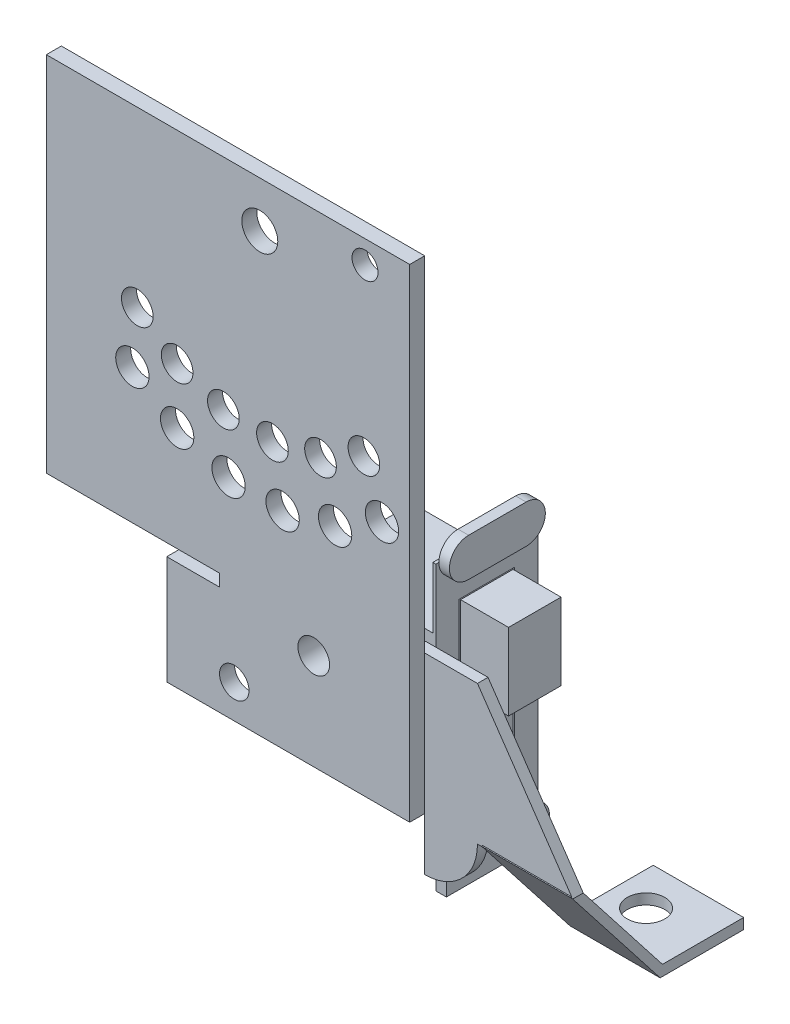
from build123d import *
from build123d.topology import SkipClean

# Parameters (mm, degrees)
SKETCH1_R                = 1.905
SKETCH1_R_2              = 1.37795
BOSS_EXTRUDE1_DEPTH      = 1.5875
CUT_EXTRUDE1_REACH       = 39.342
SKETCH2_R                = 1.7653
SKETCH2_R_2              = 1.6764
SKETCH2_R_3              = 1.5621
SKETCH3_R                = 1.6764
BOSS_EXTRUDE2_DEPTH      = 1.1176
BOSS_EXTRUDE3_DEPTH      = 0.4572
BOSS_EXTRUDE3_DEPTH_BACK = 14.732
SKETCH4_W                = 9.5758
SKETCH4_H                = 0.880680818
CUT_EXTRUDE4_DEPTH       = 57.741944576
BOSS_EXTRUDE5_DEPTH      = 0.7112
BOSS_EXTRUDE5_DEPTH_BACK = 8.128
SKETCH8_W                = 9.5758
SKETCH8_H                = 1.1176
SKETCH9_W                = 12.954
SKETCH9_H                = 15.875
BOSS_EXTRUDE10_DEPTH     = 10.795
SKETCH10_W               = 0.3175
SKETCH10_H               = 27.94
BOSS_EXTRUDE12_DEPTH     = 10.795
SKETCH11_W               = 5.55625
SKETCH11_H               = 8.128
BOSS_EXTRUDE13_DEPTH     = 5.08
SKETCH12_W               = 5.842
SKETCH12_H               = 19.05
CUT_EXTRUDE5_DEPTH       = 0.127
BOSS_EXTRUDE14_DEPTH     = 1.1176
SKETCH14_R               = 1.984375
CUT_EXTRUDE6_DEPTH       = 74.330491034


with BuildPart() as part:
    # Sketch1 → Boss-Extrude1 (new body)
    with BuildSketch(Plane.XY):
        Polygon((-19.238262945, 19.1897), (-19.238262945, -19.1897), (-0.899462945, -19.1897), (-0.899462945, -20.4724), (-6.487462945, -20.4724), (-6.487462945, -31.9659), (19.238262945, -31.9659), (19.238262945, 19.1897), align=None)
        with Locations((3.363262945, 14.309067498)):
            Circle(SKETCH1_R, mode=Mode.SUBTRACT)
        with Locations((14.507512945, 16.775557869)):
            Circle(SKETCH1_R_2, mode=Mode.SUBTRACT)
    extrude(amount=BOSS_EXTRUDE1_DEPTH)

    # Sketch2 → Cut-Extrude1 (cut, up to next)
    with BuildSketch(Plane.XY.offset(1.5875), mode=Mode.PRIVATE) as cut_extrude1_sk1:
        with Locations((16.304562945, -5.88327552)):
            Circle(SKETCH2_R)
    cut_extrude1_tool1 = extrude(cut_extrude1_sk1.sketch, amount=-CUT_EXTRUDE1_REACH, mode=Mode.PRIVATE) & part.part
    # Sketch2 → Cut-Extrude1 (cut, up to next)
    with BuildSketch(Plane.XY.offset(1.5875), mode=Mode.PRIVATE) as cut_extrude1_sk2:
        with Locations((14.386862945, -0.80327552)):
            Circle(SKETCH2_R_2)
    cut_extrude1_tool2 = extrude(cut_extrude1_sk2.sketch, amount=-CUT_EXTRUDE1_REACH, mode=Mode.PRIVATE) & part.part
    # Sketch2 → Cut-Extrude1 (cut, up to next)
    with BuildSketch(Plane.XY.offset(1.5875), mode=Mode.PRIVATE) as cut_extrude1_sk3:
        with Locations((9.794301106, -3.256364936)):
            Circle(SKETCH2_R_2)
    cut_extrude1_tool3 = extrude(cut_extrude1_sk3.sketch, amount=-CUT_EXTRUDE1_REACH, mode=Mode.PRIVATE) & part.part
    # Sketch2 → Cut-Extrude1 (cut, up to next)
    with BuildSketch(Plane.XY.offset(1.5875), mode=Mode.PRIVATE) as cut_extrude1_sk4:
        with Locations((4.703484245, -4.348544228)):
            Circle(SKETCH2_R_2)
    cut_extrude1_tool4 = extrude(cut_extrude1_sk4.sketch, amount=-CUT_EXTRUDE1_REACH, mode=Mode.PRIVATE) & part.part
    # Sketch2 → Cut-Extrude1 (cut, up to next)
    with BuildSketch(Plane.XY.offset(1.5875), mode=Mode.PRIVATE) as cut_extrude1_sk5:
        with Locations((-0.491168417, -3.995195047)):
            Circle(SKETCH2_R_2)
    cut_extrude1_tool5 = extrude(cut_extrude1_sk5.sketch, amount=-CUT_EXTRUDE1_REACH, mode=Mode.PRIVATE) & part.part
    # Sketch2 → Cut-Extrude1 (cut, up to next)
    with BuildSketch(Plane.XY.offset(1.5875), mode=Mode.PRIVATE) as cut_extrude1_sk6:
        with Locations((-5.387192811, -2.22369369)):
            Circle(SKETCH2_R_2)
    cut_extrude1_tool6 = extrude(cut_extrude1_sk6.sketch, amount=-CUT_EXTRUDE1_REACH, mode=Mode.PRIVATE) & part.part
    # Sketch2 → Cut-Extrude1 (cut, up to next)
    with BuildSketch(Plane.XY.offset(1.5875), mode=Mode.PRIVATE) as cut_extrude1_sk7:
        with Locations((-9.605261574, 0.828709926)):
            Circle(SKETCH2_R_2)
    cut_extrude1_tool7 = extrude(cut_extrude1_sk7.sketch, amount=-CUT_EXTRUDE1_REACH, mode=Mode.PRIVATE) & part.part
    # Sketch2 → Cut-Extrude1 (cut, up to next)
    with BuildSketch(Plane.XY.offset(1.5875), mode=Mode.PRIVATE) as cut_extrude1_sk8:
        with Locations((11.339611715, -8.737096142)):
            Circle(SKETCH2_R)
    cut_extrude1_tool8 = extrude(cut_extrude1_sk8.sketch, amount=-CUT_EXTRUDE1_REACH, mode=Mode.PRIVATE) & part.part
    # Sketch2 → Cut-Extrude1 (cut, up to next)
    with BuildSketch(Plane.XY.offset(1.5875), mode=Mode.PRIVATE) as cut_extrude1_sk9:
        with Locations((5.780374706, -10.111838565)):
            Circle(SKETCH2_R)
    cut_extrude1_tool9 = extrude(cut_extrude1_sk9.sketch, amount=-CUT_EXTRUDE1_REACH, mode=Mode.PRIVATE) & part.part
    # Sketch2 → Cut-Extrude1 (cut, up to next)
    with BuildSketch(Plane.XY.offset(1.5875), mode=Mode.PRIVATE) as cut_extrude1_sk10:
        with Locations((0.057562744, -9.900992408)):
            Circle(SKETCH2_R)
    cut_extrude1_tool10 = extrude(cut_extrude1_sk10.sketch, amount=-CUT_EXTRUDE1_REACH, mode=Mode.PRIVATE) & part.part
    # Sketch2 → Cut-Extrude1 (cut, up to next)
    with BuildSketch(Plane.XY.offset(1.5875), mode=Mode.PRIVATE) as cut_extrude1_sk11:
        with Locations((-5.385440111, -8.120893316)):
            Circle(SKETCH2_R)
    cut_extrude1_tool11 = extrude(cut_extrude1_sk11.sketch, amount=-CUT_EXTRUDE1_REACH, mode=Mode.PRIVATE) & part.part
    # Sketch2 → Cut-Extrude1 (cut, up to next)
    with BuildSketch(Plane.XY.offset(1.5875), mode=Mode.PRIVATE) as cut_extrude1_sk12:
        with Locations((-10.12692846, -4.90945733)):
            Circle(SKETCH2_R)
    cut_extrude1_tool12 = extrude(cut_extrude1_sk12.sketch, amount=-CUT_EXTRUDE1_REACH, mode=Mode.PRIVATE) & part.part
    # Sketch2 → Cut-Extrude1 (cut, up to next)
    with BuildSketch(Plane.XY.offset(1.5875), mode=Mode.PRIVATE) as cut_extrude1_sk13:
        with Locations((9.078262945, -21.7805)):
            Circle(SKETCH2_R_2)
    cut_extrude1_tool13 = extrude(cut_extrude1_sk13.sketch, amount=-CUT_EXTRUDE1_REACH, mode=Mode.PRIVATE) & part.part
    # Sketch2 → Cut-Extrude1 (cut, up to next)
    with BuildSketch(Plane.XY.offset(1.5875), mode=Mode.PRIVATE) as cut_extrude1_sk14:
        with Locations((0.662637055, -28.4099)):
            Circle(SKETCH2_R_3)
    cut_extrude1_tool14 = extrude(cut_extrude1_sk14.sketch, amount=-CUT_EXTRUDE1_REACH, mode=Mode.PRIVATE) & part.part
    add(cut_extrude1_tool1.solids().sort_by_distance((16.304563, -5.883276, 1.5875))[0], mode=Mode.SUBTRACT)
    add(cut_extrude1_tool2.solids().sort_by_distance((14.386863, -0.803276, 1.5875))[0], mode=Mode.SUBTRACT)
    add(cut_extrude1_tool3.solids().sort_by_distance((9.794301, -3.256365, 1.5875))[0], mode=Mode.SUBTRACT)
    add(cut_extrude1_tool4.solids().sort_by_distance((4.703484, -4.348544, 1.5875))[0], mode=Mode.SUBTRACT)
    add(cut_extrude1_tool5.solids().sort_by_distance((-0.491168, -3.995195, 1.5875))[0], mode=Mode.SUBTRACT)
    add(cut_extrude1_tool6.solids().sort_by_distance((-5.387193, -2.223694, 1.5875))[0], mode=Mode.SUBTRACT)
    add(cut_extrude1_tool7.solids().sort_by_distance((-9.605262, 0.82871, 1.5875))[0], mode=Mode.SUBTRACT)
    add(cut_extrude1_tool8.solids().sort_by_distance((11.339612, -8.737096, 1.5875))[0], mode=Mode.SUBTRACT)
    add(cut_extrude1_tool9.solids().sort_by_distance((5.780375, -10.111839, 1.5875))[0], mode=Mode.SUBTRACT)
    add(cut_extrude1_tool10.solids().sort_by_distance((0.057563, -9.900992, 1.5875))[0], mode=Mode.SUBTRACT)
    add(cut_extrude1_tool11.solids().sort_by_distance((-5.38544, -8.120893, 1.5875))[0], mode=Mode.SUBTRACT)
    add(cut_extrude1_tool12.solids().sort_by_distance((-10.126928, -4.909457, 1.5875))[0], mode=Mode.SUBTRACT)
    add(cut_extrude1_tool13.solids().sort_by_distance((9.078263, -21.7805, 1.5875))[0], mode=Mode.SUBTRACT)
    add(cut_extrude1_tool14.solids().sort_by_distance((0.662637, -28.4099, 1.5875))[0], mode=Mode.SUBTRACT)

    # Sketch3 → Boss-Extrude2 (add)
    with SkipClean():  # the faces are left unmerged after this step: merging them gives an invalid solid
        with BuildSketch(Plane(origin=(0, 0, 0), x_dir=(-1, 0, 0), z_dir=(0, 0, -1))):
            with BuildLine():
                Line((-24.826262945, -17.2339), (-34.910062945, -31.9659))
                Line((-34.910062945, -31.9659), (-24.826262945, -31.9659))
                ThreePointArc((-24.826262945, -31.9659), (-23.189575638, -35.917212693), (-19.238262945, -37.5539))
                Line((-19.238262945, -37.5539), (-19.238262945, -31.9659))
                Line((-19.238262945, -31.9659), (-18.222262945, -31.9659))
                Line((-18.222262945, -31.9659), (-18.222262945, -30.4419))
                Line((-18.222262945, -30.4419), (-6.030262945, -30.4419))
                Line((-6.030262945, -30.4419), (-6.030262945, -18.7579))
                Line((-6.030262945, -18.7579), (-18.222262945, -18.7579))
                Line((-18.222262945, -18.7579), (-18.222262945, -17.2339))
                Line((-18.222262945, -17.2339), (-24.826262945, -17.2339))
            make_face()
            with Locations((-9.078262945, -21.7805)):
                Circle(SKETCH3_R, mode=Mode.SUBTRACT)
        extrude(amount=BOSS_EXTRUDE2_DEPTH)

    # Sketch4 → Boss-Extrude3 (add, two sides: drawn at the far end of the back side and taken through both)
    with SkipClean():  # the faces are left unmerged after this step: merging them gives an invalid solid
        with BuildSketch(Plane(origin=(0, -20.120676187, -15.719995101), x_dir=(-1, 0, 0), z_dir=(0, 0.7880107536067232, 0.6156614753256567)).offset(-BOSS_EXTRUDE3_DEPTH_BACK)):
            with Locations((-30.122162945, 19.239832745)):
                Rectangle(SKETCH4_W, SKETCH4_H)
        extrude(amount=BOSS_EXTRUDE3_DEPTH + BOSS_EXTRUDE3_DEPTH_BACK)

    # Sketch7 → Cut-Extrude4 (cut, through all)
    with SkipClean():  # the faces are left unmerged after this step: merging them gives an invalid solid
        with BuildSketch(Plane(origin=(0, 0, -1.1176), x_dir=(-1, 0, 0), z_dir=(0, 0, -1))):
            Polygon((-34.477894808, -31.334520858), (-34.910062945, -31.334520858), (-34.910062945, -31.9659), align=None)
        extrude(amount=-CUT_EXTRUDE4_DEPTH, mode=Mode.SUBTRACT)

    # Sketch8 → Boss-Extrude5 (add, two sides: drawn at the far end of the back side and taken through both)
    with SkipClean():  # the faces are left unmerged after this step: merging them gives an invalid solid
        with BuildSketch(Plane.XY.offset(-9.975717832).offset(-BOSS_EXTRUDE5_DEPTH_BACK)):
            with Locations((30.122162945, -43.263395546)):
                Rectangle(SKETCH8_W, SKETCH8_H)
        extrude(amount=BOSS_EXTRUDE5_DEPTH + BOSS_EXTRUDE5_DEPTH_BACK)

    # Sketch9 → Boss-Extrude10 (add)
    with SkipClean():  # the faces are left unmerged after this step: merging them gives an invalid solid
        with BuildSketch(Plane(origin=(0, 0, -1.1176), x_dir=(-1, 0, 0), z_dir=(0, 0, -1))):
            with Locations((-12.507262945, -24.0284)):
                Rectangle(SKETCH9_W, SKETCH9_H)
        extrude(amount=BOSS_EXTRUDE10_DEPTH)

    # Sketch10 → Boss-Extrude12 (add)
    with SkipClean():  # the faces are left unmerged after this step: merging them gives an invalid solid
        with BuildSketch(Plane(origin=(0, 0, -1.1176), x_dir=(-1, 0, 0), z_dir=(0, 0, -1))):
            with Locations((-19.143012945, -23.583539193)):
                Rectangle(SKETCH10_W, SKETCH10_H)
        extrude(amount=BOSS_EXTRUDE12_DEPTH)

    # Sketch11 → Boss-Extrude13 (add)
    with SkipClean():  # the faces are left unmerged after this step: merging them gives an invalid solid
        with BuildSketch(Plane(origin=(19.301762945, 0, 0), x_dir=(0, 0, -1), z_dir=(1, 0, 0))):
            with Locations((6.5151, -18.248227099)):
                Rectangle(SKETCH11_W, SKETCH11_H)
        extrude(amount=BOSS_EXTRUDE13_DEPTH)

    # Sketch12 → Cut-Extrude5 (cut)
    with SkipClean():  # the faces are left unmerged after this step: merging them gives an invalid solid
        with BuildSketch(Plane(origin=(19.301762945, 0, 0), x_dir=(0, 0, -1), z_dir=(1, 0, 0))):
            with Locations((6.5151, -23.583539193)):
                Rectangle(SKETCH12_W, SKETCH12_H)
        extrude(amount=-CUT_EXTRUDE5_DEPTH, mode=Mode.SUBTRACT)


with BuildPart() as cut_extrude5_piece_1:
    # of the separate pieces the step leaves, piece 1, a body of its own (cut_extrude5_pieces)
    add(part.part.solids().sort_by_distance((19.238262945, 19.1897, 0))[0])

    # Sketch13 → Boss-Extrude14 (add)
    with SkipClean():  # the faces are left unmerged after this step: merging them gives an invalid solid
        with BuildSketch(Plane(origin=(19.301762945, 0, 0), x_dir=(0, 0, -1), z_dir=(1, 0, 0))):
            with BuildLine():
                Line((10.0076, -35.521539193), (1.1176, -35.521539193))
                Line((1.1176, -35.521539193), (1.1176, -39.585539193))
                Line((1.1176, -39.585539193), (10.0076, -39.585539193))
                ThreePointArc((10.0076, -39.585539193), (12.0396, -37.553539193), (10.0076, -35.521539193))
            make_face()
            with BuildLine():
                Line((3.4671, -7.581539193), (9.5631, -7.581539193))
                ThreePointArc((9.5631, -7.581539193), (11.5951, -9.613539193), (9.5631, -11.645539193))
                Line((9.5631, -11.645539193), (3.4671, -11.645539193))
                ThreePointArc((3.4671, -11.645539193), (1.4351, -9.613539193), (3.4671, -7.581539193))
            make_face()
        extrude(amount=BOSS_EXTRUDE14_DEPTH)

    # Sketch14 → Cut-Extrude6 (cut, through all)
    with SkipClean():  # the faces are left unmerged after this step: merging them gives an invalid solid
        with BuildSketch(Plane(origin=(0, -42.704595546, 0), x_dir=(1, 0, 0), z_dir=(0, 1, 0))):
            with Locations((28.890262945, 13.785717832)):
                Circle(SKETCH14_R)
        extrude(amount=-CUT_EXTRUDE6_DEPTH, mode=Mode.SUBTRACT)


with BuildPart() as cut_extrude5_piece_2:
    # of the separate pieces the step leaves, piece 2, a body of its own (cut_extrude5_pieces)
    add(part.part.solids().sort_by_distance((19.301762945, -14.184227099, -3.736975))[0])


solid = Compound([cut_extrude5_piece_1.part, cut_extrude5_piece_2.part])
